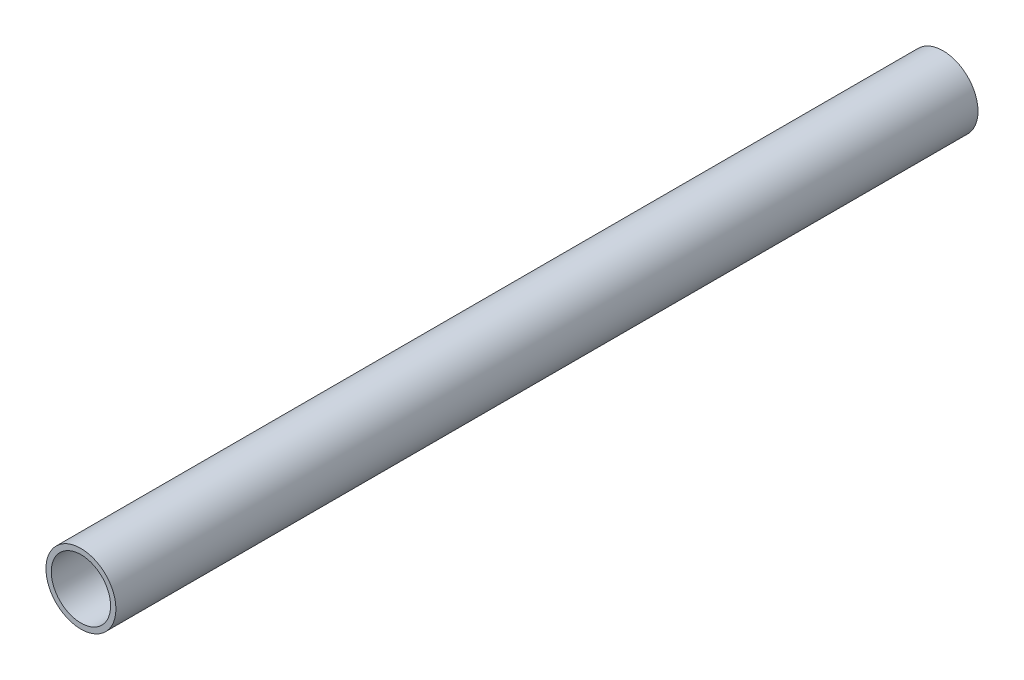
from build123d import *

# Parameters (mm, degrees)
SKETCH1_R           = 6.9
SKETCH1_R_2         = 5.85
BOSS_EXTRUDE1_DEPTH = 170


with BuildPart() as part:
    # Sketch1 → Boss-Extrude1 (new body)
    with BuildSketch(Plane.XY):
        Circle(SKETCH1_R)
        Circle(SKETCH1_R_2, mode=Mode.SUBTRACT)
    extrude(amount=BOSS_EXTRUDE1_DEPTH)


solid = part.part
